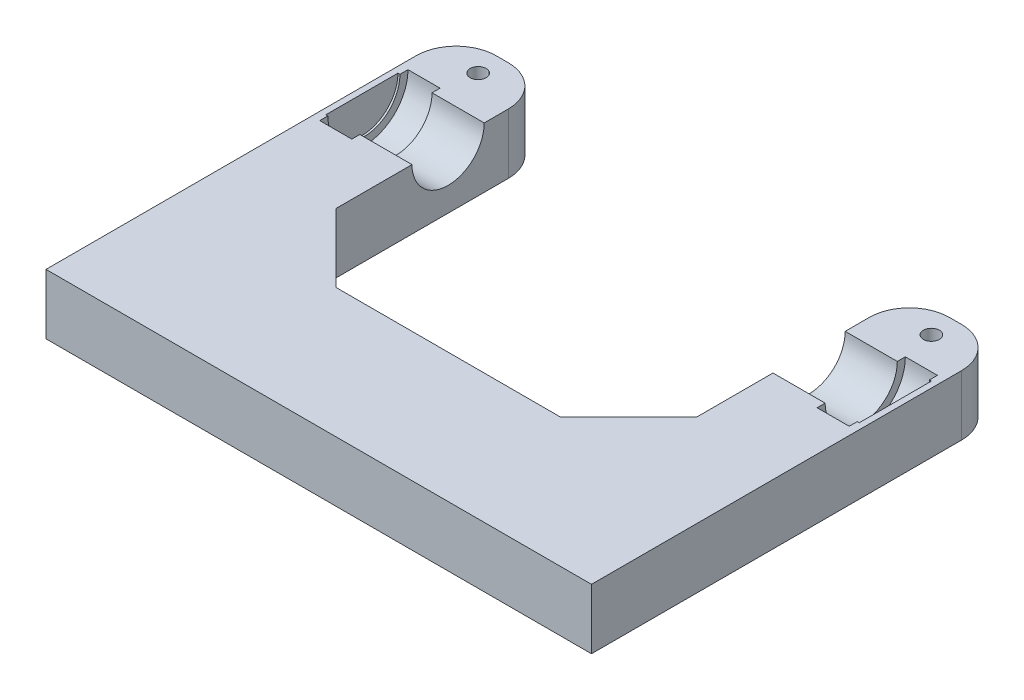
from build123d import *

# Parameters (mm, degrees)
BOSS_EXTRUDE1_DEPTH = 15
SKETCH2_R           = 9
CUT_EXTRUDE1_DEPTH  = 66.5
CUT_EXTRUDE2_START  = -58
SKETCH4_R           = 11
CUT_EXTRUDE2_DEPTH  = 8
CHAMFER1_SIZE       = 17
SKETCH5_R           = 2
CUT_EXTRUDE3_DEPTH  = 105.002294435
FILLET1_R           = 10


with BuildPart() as part:
    # Sketch1 → Boss-Extrude1 (new body)
    with BuildSketch(Plane(origin=(0, 0, 0), x_dir=(1, 0, 0), z_dir=(0, 1, 0))):
        Polygon((-45, 25), (-68, 25), (-68, -77.249448203), (68, -77.249448203), (68, 25), (45, 25), (45, -45), (-45, -45), align=None)
    extrude(amount=-BOSS_EXTRUDE1_DEPTH)

    # Sketch2 → Cut-Extrude1 (cut)
    with BuildSketch(Plane(origin=(0, 0, 0), x_dir=(0, 0, -1), z_dir=(1, 0, 0))):
        Circle(SKETCH2_R)
    cut_extrude1 = extrude(amount=-CUT_EXTRUDE1_DEPTH, mode=Mode.SUBTRACT)

    # Sketch4 → Cut-Extrude2 (cut)
    with BuildSketch(Plane(origin=(0, 0, 0), x_dir=(0, 0, -1), z_dir=(1, 0, 0)).offset(CUT_EXTRUDE2_START)):
        Circle(SKETCH4_R)
    cut_extrude2 = extrude(amount=-CUT_EXTRUDE2_DEPTH, mode=Mode.SUBTRACT)

    # Chamfer1
    chamfer1_edges = [part.edges().sort_by_distance(p)[0] for p in [
        (-45, -7.5, 45),
        (45, -7.5, 45),
    ]]
    chamfer(chamfer1_edges, length=CHAMFER1_SIZE)

    # Sketch5 → Cut-Extrude3 (cut, through all)
    with BuildSketch(Plane(origin=(0, 0, 0), x_dir=(1, 0, 0), z_dir=(0, 1, 0))):
        with Locations(Location((-56.5, 19, 0), (0, 0, 270))):
            Circle(SKETCH5_R)
    cut_extrude3 = extrude(amount=-CUT_EXTRUDE3_DEPTH, mode=Mode.SUBTRACT)

    # Fillet1
    fillet1_edges = [part.edges().sort_by_distance(p)[0] for p in [
        (45, -7.5, -25),
        (68, -7.5, -25),
        (-68, -7.5, -25),
        (-45, -7.5, -25),
    ]]
    fillet(fillet1_edges, radius=FILLET1_R)

    # Mirror2: Cut-Extrude1, Cut-Extrude2, Cut-Extrude3 across plane
    add(cut_extrude1.mirror(Plane(origin=(0, 0, 0), x_dir=(0, 0, 1), z_dir=(1, 0, 0))), mode=Mode.SUBTRACT)
    add(cut_extrude2.mirror(Plane(origin=(0, 0, 0), x_dir=(0, 0, 1), z_dir=(1, 0, 0))), mode=Mode.SUBTRACT)
    add(cut_extrude3.mirror(Plane(origin=(0, 0, 0), x_dir=(0, 0, 1), z_dir=(1, 0, 0))), mode=Mode.SUBTRACT)


solid = part.part
